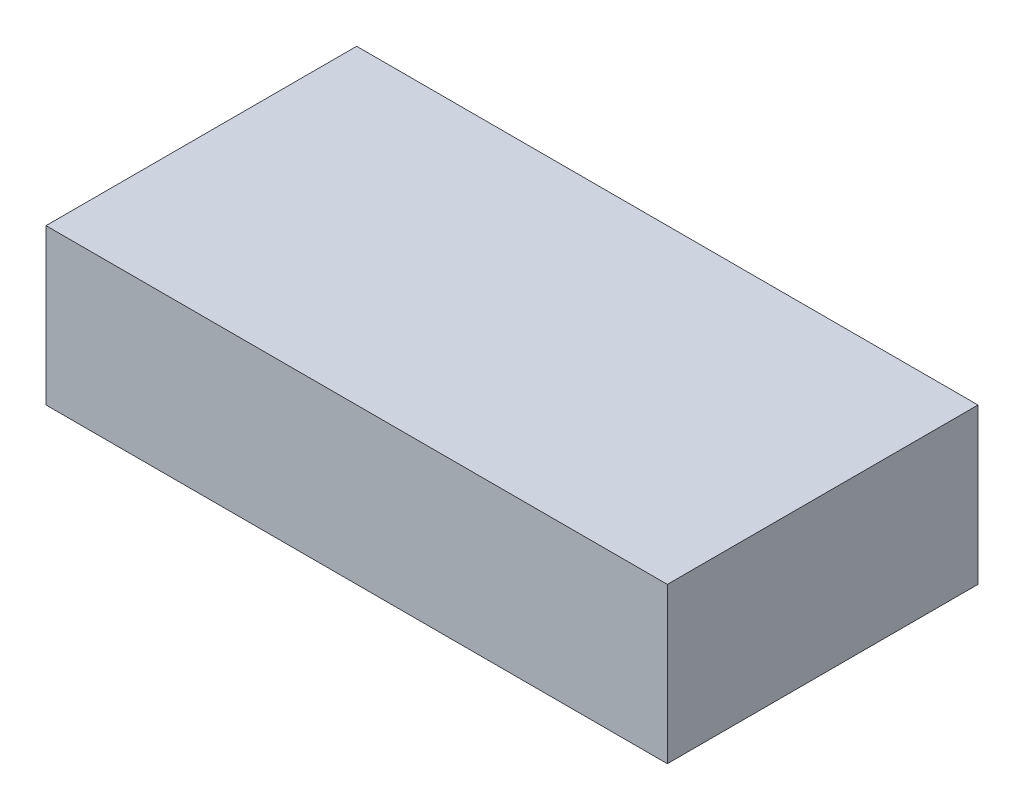
from build123d import *

# Parameters (mm, degrees)
CROQUIS2_W              = 200
CROQUIS2_H              = 100
SALIENTE_EXTRUIR2_DEPTH = 50


with BuildPart() as part:
    # Croquis2 → Saliente-Extruir2 (new body)
    with BuildSketch(Plane(origin=(0, 0, 0), x_dir=(1, 0, 0), z_dir=(0, 1, 0))):
        Rectangle(CROQUIS2_W, CROQUIS2_H)
    extrude(amount=SALIENTE_EXTRUIR2_DEPTH)


solid = part.part
